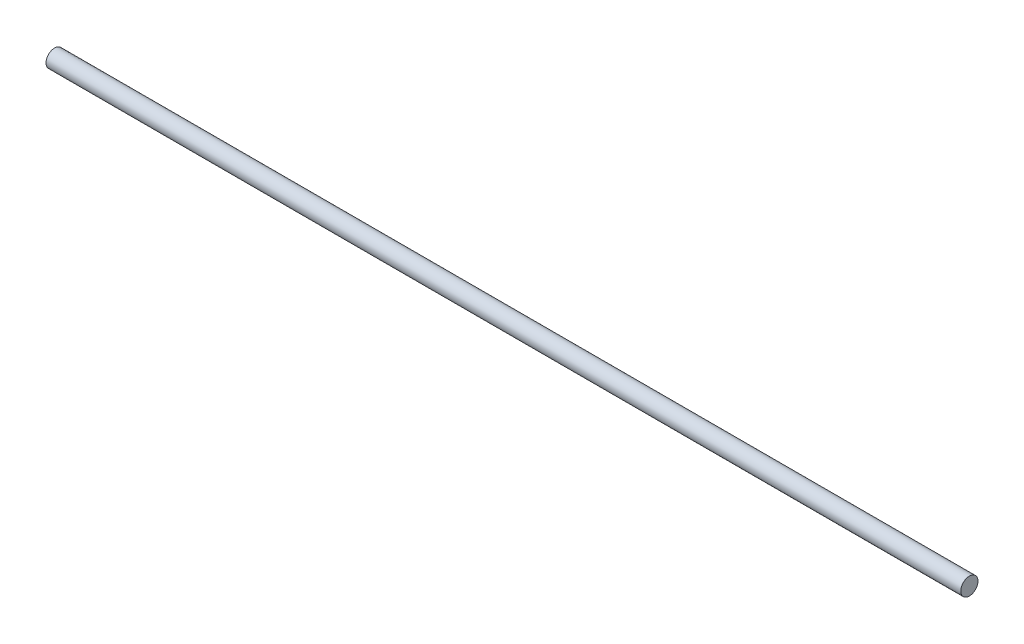
from build123d import *

# Parameters (mm, degrees)
SKETCH1_R           = 2.5
BOSS_EXTRUDE1_DEPTH = 265


with BuildPart() as part:
    # Sketch1 → Boss-Extrude1 (new body)
    with BuildSketch(Plane(origin=(0, 0, 0), x_dir=(0, 0, -1), z_dir=(1, 0, 0))):
        Circle(SKETCH1_R)
    extrude(amount=BOSS_EXTRUDE1_DEPTH)


solid = part.part
